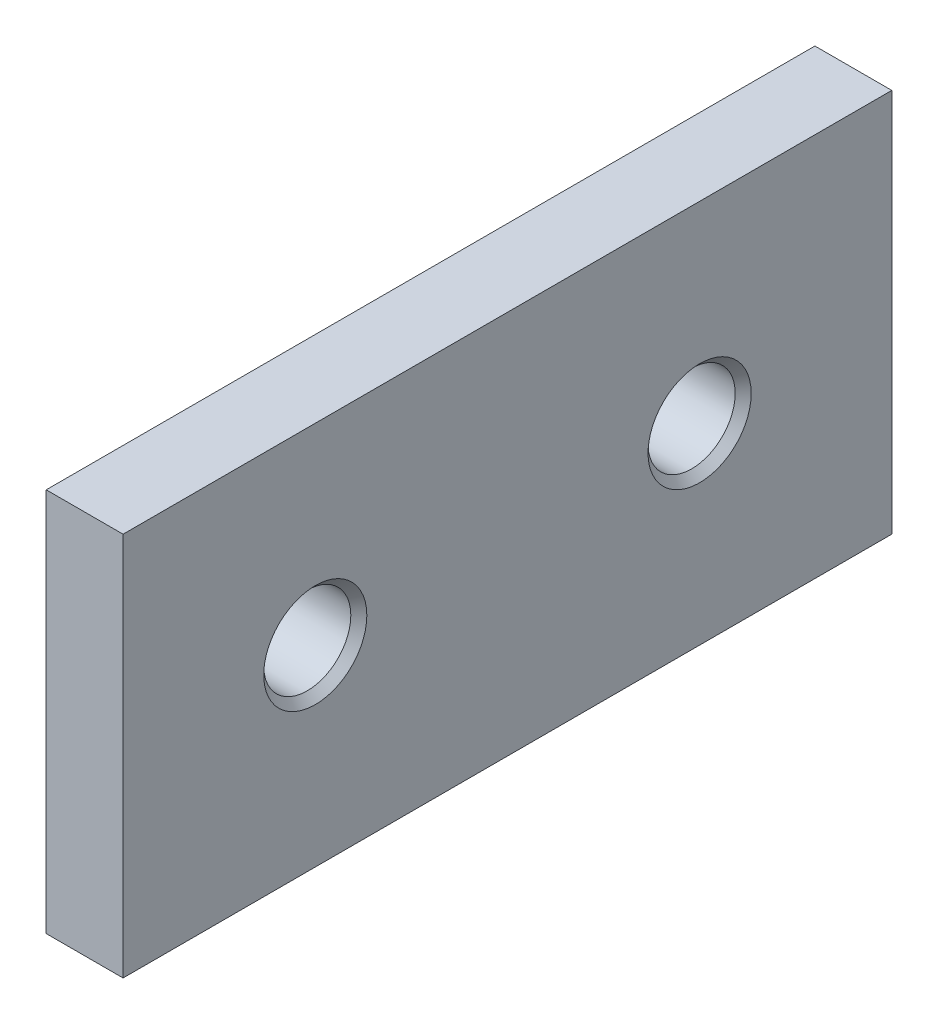
from build123d import *

# Parameters (mm, degrees)
SKETCH_3_W                  = 60
SKETCH_3_H                  = 30
EXTRUDE_2_DEPTH             = 3
HOLE_WIZARD_M84_D           = 6.8
HOLE_WIZARD_M84_CSINK_D     = 8.05
HOLE_WIZARD_M84_CSINK_ANGLE = 90


with BuildPart() as part:
    # Эскиз3 → Бобышка-Вытянуть2 (new, symmetric)
    with BuildSketch(Plane(origin=(56, 0, 0), x_dir=(0, 0, -1), z_dir=(1, 0, 0))):
        with Locations((0, 70)):
            Rectangle(SKETCH_3_W, SKETCH_3_H)
    extrude(amount=EXTRUDE_2_DEPTH, both=True)

    # Отверстие обработанное метчиком M84 (through all)
    with Locations(Plane(origin=(59, 0, 0), x_dir=(0, 0, -1), z_dir=(1, 0, 0))):
        with Locations((-15, 70), (15, 70)):
            CounterSinkHole(HOLE_WIZARD_M84_D / 2, HOLE_WIZARD_M84_CSINK_D / 2, counter_sink_angle=HOLE_WIZARD_M84_CSINK_ANGLE)


solid = part.part
